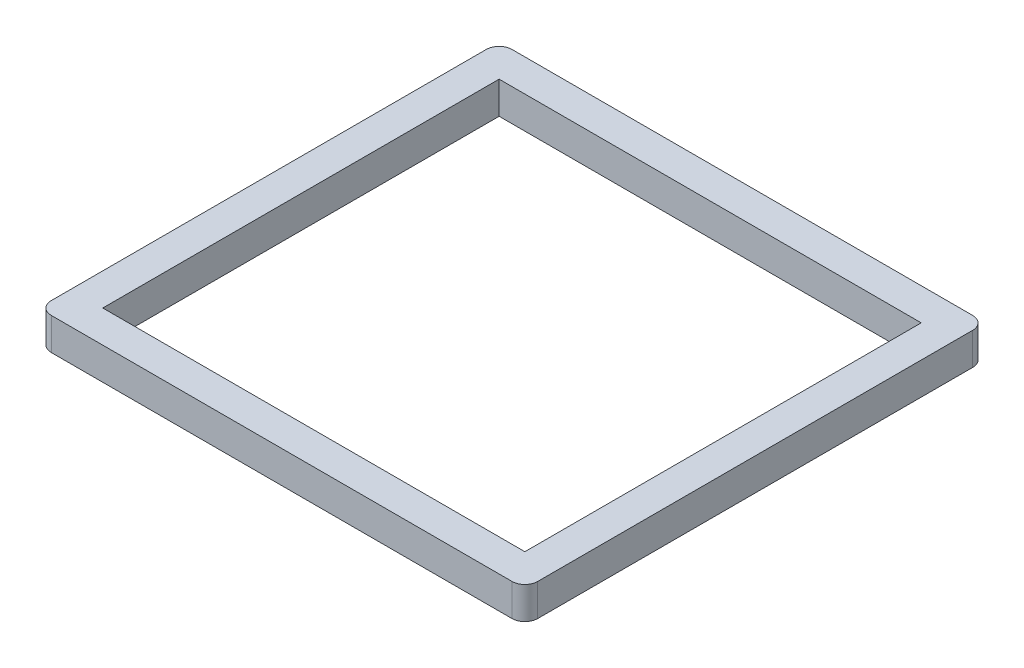
from build123d import *

# Parameters (mm, degrees)
SKETCH1_W           = 83.312
SKETCH1_H           = 78.232
BOSS_EXTRUDE1_DEPTH = 6.35


with BuildPart() as part:
    # Sketch1 → Boss-Extrude1 (new body)
    with BuildSketch(Plane(origin=(0, 0, 0), x_dir=(1, 0, 0), z_dir=(0, 1, 0))):
        with BuildLine():
            Line((-45.466, 45.466), (45.466, 45.466))
            ThreePointArc((45.466, 45.466), (47.262051224, 44.722051224), (48.006, 42.926))
            Line((48.006, 42.926), (48.006, -42.926))
            ThreePointArc((48.006, -42.926), (47.262051224, -44.722051224), (45.466, -45.466))
            Line((45.466, -45.466), (-45.466, -45.466))
            ThreePointArc((-45.466, -45.466), (-47.262051224, -44.722051224), (-48.006, -42.926))
            Line((-48.006, -42.926), (-48.006, 42.926))
            ThreePointArc((-48.006, 42.926), (-47.262051224, 44.722051224), (-45.466, 45.466))
        make_face()
        Rectangle(SKETCH1_W, SKETCH1_H, mode=Mode.SUBTRACT)
    extrude(amount=BOSS_EXTRUDE1_DEPTH)


solid = part.part
